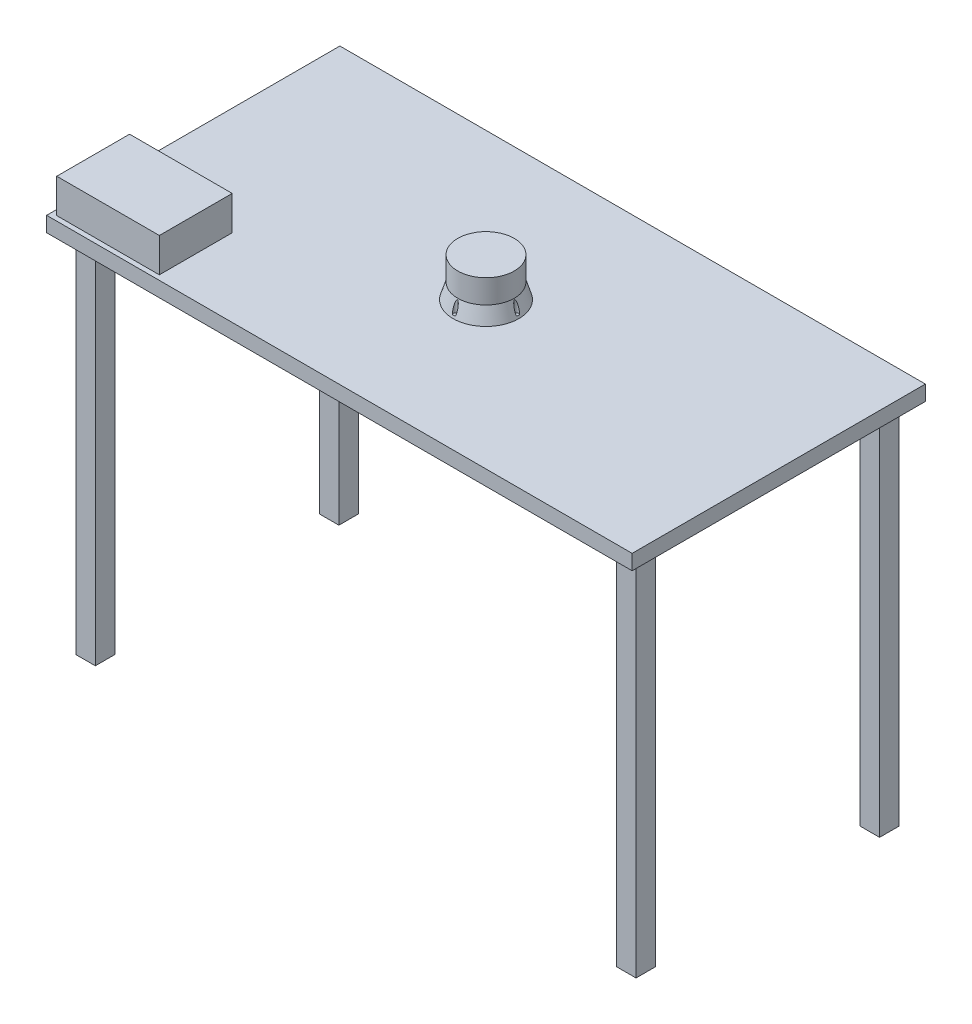
from build123d import *

# Parameters (mm, degrees)
CORTAR_EXTRUIR1_START   = -50
CROQUIS2_R              = 4.324629937
CORTAR_EXTRUIR1_DEPTH   = 25
CROQUIS3_W              = 1202
CROQUIS3_H              = 602
SALIENTE_EXTRUIR1_DEPTH = 31
CROQUIS4_W              = 40
CROQUIS4_H              = 40
SALIENTE_EXTRUIR2_DEPTH = 750
CROQUIS5_W              = 210.655681701
CROQUIS5_H              = 149.539527133
SALIENTE_EXTRUIR3_DEPTH = 70


with BuildPart() as part:
    # Croquis1 → Revolución1 (revolve)
    with BuildSketch(Plane.XY, mode=Mode.PRIVATE) as revoluci_n1_sk:
        Polygon((0, 0), (0, 80), (-58, 80), (-58, 31.455108359), (-67.5, 0), align=None)
    revolve(revoluci_n1_sk.sketch.rotate(Axis((0, 0, 0), (0, 1, 0)), 180), axis=Axis((0, 0, 0), (0, 1, 0)))

    # Croquis2 → Cortar-Extruir1 (cut)
    with BuildSketch(Plane(origin=(0, 80, 0), x_dir=(1, 0, 0), z_dir=(0, 1, 0)).offset(CORTAR_EXTRUIR1_START)):
        with Locations((0, 63.025248345)):
            Circle(CROQUIS2_R)
        with Locations((63.025248345, 0)):
            Circle(CROQUIS2_R)
        with Locations((0, -63.025248345)):
            Circle(CROQUIS2_R)
        with Locations((-63.025248345, 0)):
            Circle(CROQUIS2_R)
    extrude(amount=-CORTAR_EXTRUIR1_DEPTH, mode=Mode.SUBTRACT)

    # Croquis3 → Saliente-Extruir1 (add)
    with BuildSketch(Plane.XZ):
        Rectangle(CROQUIS3_W, CROQUIS3_H)
    extrude(amount=SALIENTE_EXTRUIR1_DEPTH)

    # Croquis4 → Saliente-Extruir2 (add)
    with BuildSketch(Plane.XZ.offset(31)):
        with Locations((-551, 251)):
            Rectangle(CROQUIS4_W, CROQUIS4_H)
        with Locations((559, 251)):
            Rectangle(CROQUIS4_W, CROQUIS4_H)
        with Locations((559, -249)):
            Rectangle(CROQUIS4_W, CROQUIS4_H)
        with Locations((-551, -249)):
            Rectangle(CROQUIS4_W, CROQUIS4_H)
    extrude(amount=SALIENTE_EXTRUIR2_DEPTH)

    # Croquis5 → Saliente-Extruir3 (add)
    with BuildSketch(Plane(origin=(0, 0, 0), x_dir=(1, 0, 0), z_dir=(0, 1, 0))):
        with Locations((-484.76769938, -216.371921998)):
            Rectangle(CROQUIS5_W, CROQUIS5_H)
    extrude(amount=SALIENTE_EXTRUIR3_DEPTH)


solid = part.part
